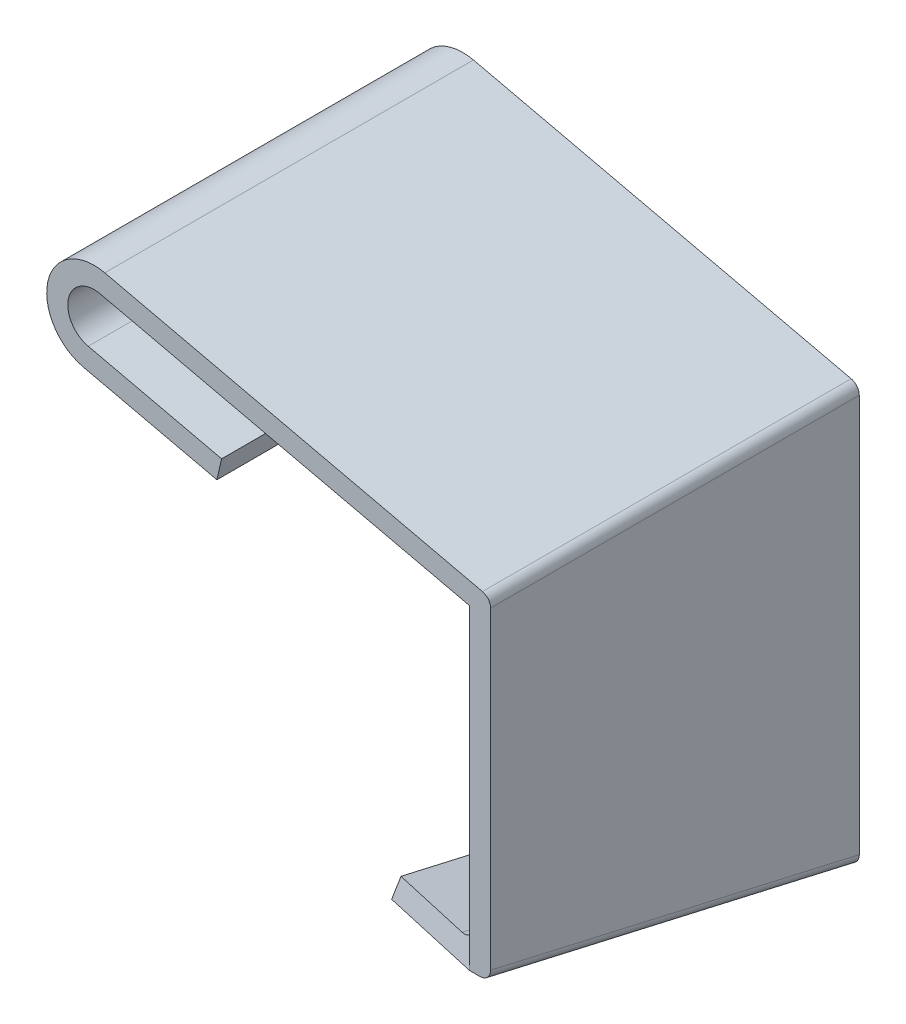
from build123d import *

# Parameters (mm, degrees)
EXTRUS_O_FINA1_DEPTH     = 35
RESSALTO_EXTRUS_O1_DEPTH = 2
ESBO_O4_W                = 35.902646142
ESBO_O4_H                = 2
EXTRUS_O_FINA2_DEPTH     = 8
FILETE1_R                = 1


with BuildPart() as part:
    # Esboço1 → Extrusão-Fina1 (new body)
    with BuildSketch(Plane.XY):
        with BuildLine():
            Line((0, -9.06918845), (0, 20.93081155))
            Line((0, 20.93081155), (-35.077322332, 29.029049507))
            ThreePointArc((-35.077322332, 29.029049507), (-38.07562513, 27.155501981), (-36.202077604, 24.157199183))
            Line((-36.202077604, 24.157199183), (-23.535266762, 21.232835476))
            Line((-23.535266762, 21.232835476), (-23.98516887, 19.284095347))
            Line((-23.98516887, 19.284095347), (-36.651979713, 22.208459053))
            ThreePointArc((-36.651979713, 22.208459053), (-40.02436526, 27.605404089), (-34.627420224, 30.977789636))
            Line((-34.627420224, 30.977789636), (2, 22.521683384))
            Line((2, 22.521683384), (2, -9.06918845))
            Line((2, -9.06918845), (0, -9.06918845))
        make_face()
    extrude(amount=EXTRUS_O_FINA1_DEPTH)

    # Esboço2 → Ressalto-extrusão1 (add)
    with BuildSketch(Plane(origin=(0, 0, 0), x_dir=(0, 0, -1), z_dir=(1, 0, 0))):
        Polygon((0, -9.06918845), (-35, -9.06918845), (0, -17.06918845), align=None)
    extrude(amount=RESSALTO_EXTRUS_O1_DEPTH)

    # Esboço4 → Extrusão-Fina2 (add)
    with BuildSketch(Plane(origin=(3.647257489, -0.820865703, 0.187626446), x_dir=(0, 0.2228248015021411, 0.9748585065718673), z_dir=(0.9743700647852352, -0.21929544888942776, 0.050124674031869196))):
        with Locations((14.147884543, 15.213560322)):
            Rectangle(ESBO_O4_W, ESBO_O4_H)
    extrude(amount=-EXTRUS_O_FINA2_DEPTH)

    # Filete1
    filete1_edges = [part.edges().sort_by_distance(p)[0] for p in [
        (2, 22.521683384, 17.5),
        (2, -13.06918845, 17.5),
        (0, -11.015914782, 17.271313991),
    ]]
    fillet(filete1_edges, radius=FILETE1_R)


solid = part.part
